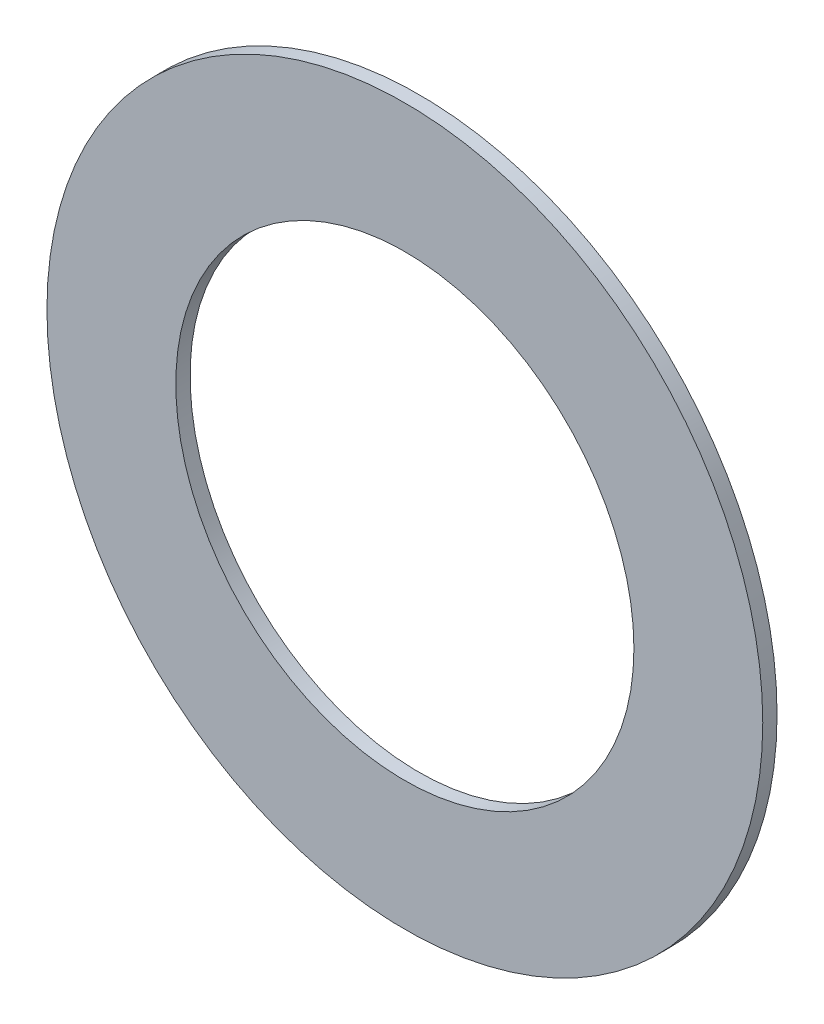
from build123d import *

# Parameters (mm, degrees)
SKETCH1_R           = 19.84375
SKETCH1_R_2         = 12.7
BOSS_EXTRUDE1_DEPTH = 0.79248


with BuildPart() as part:
    # Sketch1 → Boss-Extrude1 (new body)
    with BuildSketch(Plane.XY):
        Circle(SKETCH1_R)
        Circle(SKETCH1_R_2, mode=Mode.SUBTRACT)
    extrude(amount=BOSS_EXTRUDE1_DEPTH)


solid = part.part
